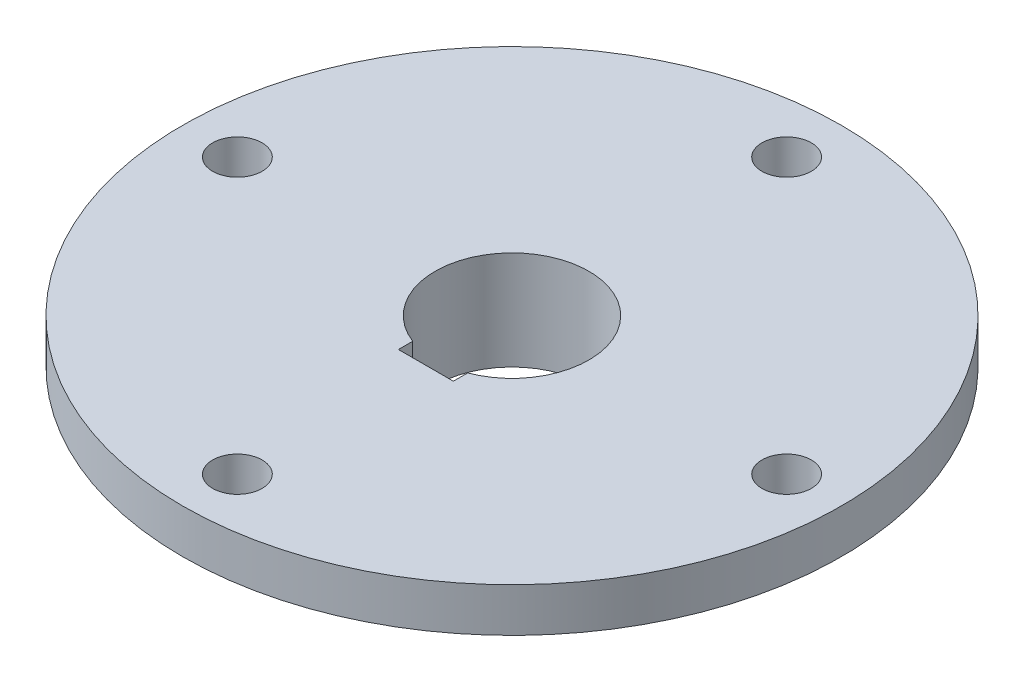
from build123d import *

# Parameters (mm, degrees)
SKIZZE1_R                            = 20.5
SKIZZE1_R_2                          = 7
AUFSATZ_LINEAR_AUSTRAGEN1_DEPTH      = 5
SKIZZE3_R                            = 30
SKIZZE3_R_2                          = 7
AUFSATZ_LINEAR_AUSTRAGEN2_DEPTH      = 4
DURCHGANGSLOCH_F_R_M41_D             = 4.5
SCHNITT_LINEAR_AUSTRAGEN1_DEPTH      = 44.370496884
SCHNITT_LINEAR_AUSTRAGEN1_DEPTH_BACK = 44.370496884


with BuildPart() as part:
    # Skizze1 → Aufsatz-Linear austragen1 (new body)
    with BuildSketch(Plane(origin=(0, 0, 0), x_dir=(1, 0, 0), z_dir=(0, 1, 0))):
        with Locations(Location((0, 0, 0), (0, 0, 270))):
            Circle(SKIZZE1_R)
        with Locations(Location((0, 0, 0), (0, 0, 270))):
            Circle(SKIZZE1_R_2, mode=Mode.SUBTRACT)
    extrude(amount=AUFSATZ_LINEAR_AUSTRAGEN1_DEPTH)

    # Skizze3 → Aufsatz-Linear austragen2 (add)
    with BuildSketch(Plane(origin=(0, 5, 0), x_dir=(1, 0, 0), z_dir=(0, 1, 0))):
        with Locations(Location((0, 0, 0), (0, 0, 270))):
            Circle(SKIZZE3_R)
        with Locations(Location((0, 0, 0), (0, 0, 270))):
            Circle(SKIZZE3_R_2, mode=Mode.SUBTRACT)
    extrude(amount=AUFSATZ_LINEAR_AUSTRAGEN2_DEPTH)

    # Durchgangsloch für M41 (through all)
    with Locations(Plane(origin=(0, 5, 0), x_dir=(-1, 0, 0), z_dir=(0, -1, 0))):
        with Locations((0, 25), (-25, 0), (0, -25), (25, 0)):
            Hole(DURCHGANGSLOCH_F_R_M41_D / 2)

    # Skizze6 → Schnitt-Linear austragen1 (cut, two sides: drawn at the far end of the back side and taken through both)
    with BuildSketch(Plane.XZ.offset(-SCHNITT_LINEAR_AUSTRAGEN1_DEPTH_BACK)):
        with BuildLine():
            Line((2.5, 7.838348415), (-2.5, 7.838348415))
            Line((-2.5, 7.838348415), (-2.5, 6.538348415))
            ThreePointArc((-2.5, 6.538348415), (0, 7), (2.5, 6.538348415))
            Line((2.5, 6.538348415), (2.5, 7.838348415))
        make_face()
    extrude(amount=SCHNITT_LINEAR_AUSTRAGEN1_DEPTH + SCHNITT_LINEAR_AUSTRAGEN1_DEPTH_BACK, mode=Mode.SUBTRACT)


solid = part.part
